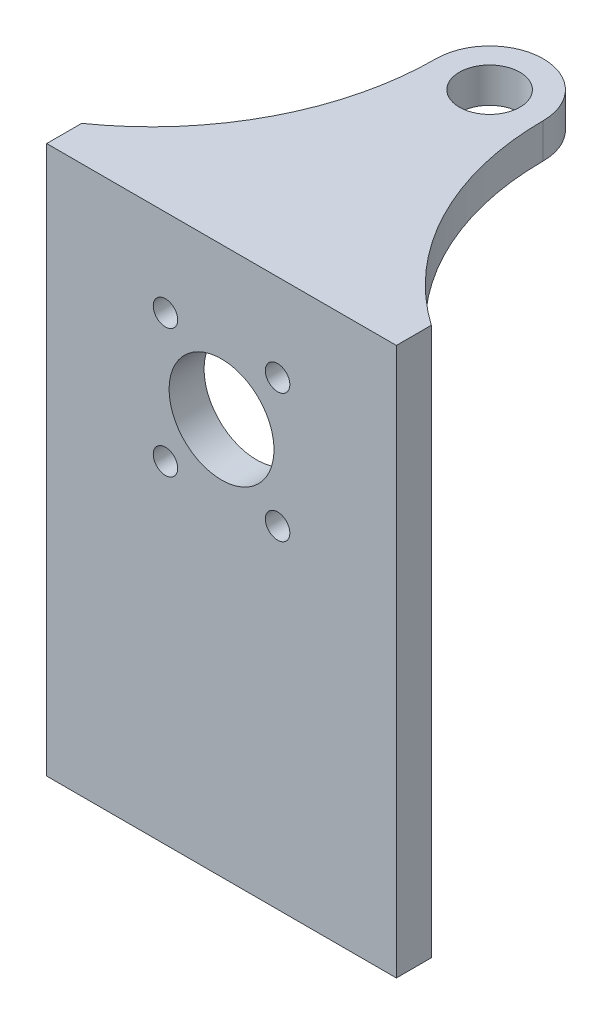
from build123d import *

# Parameters (mm, degrees)
BOSS_EXTRUDE1_DEPTH             = 3
SKETCH2_W                       = 30
SKETCH2_H                       = 3
BOSS_EXTRUDE2_DEPTH             = 44
BOSS_EXTRUDE2_DIRECTION_2_REACH = 76.018
SKETCH3_R                       = 1
CUT_EXTRUDE1_DEPTH              = 10
SKETCH5_R                       = 4.5
SKETCH5_R_2                     = 1.05
CUT_EXTRUDE2_DEPTH              = 90.56424105


with BuildPart() as part:
    # Sketch1 → Boss-Extrude1 (new body)
    with BuildSketch(Plane(origin=(0, 0, 0), x_dir=(1, 0, 0), z_dir=(0, 1, 0))):
        with BuildLine():
            ThreePointArc((-52.563656192, 11.590548397), (-53.910964998, 14.843239591), (-57.163656192, 16.190548397))
            Line((-57.163656192, 16.190548397), (-57.163656192, 14.190548397))
            ThreePointArc((-57.163656192, 14.190548397), (-55.32517856, 13.429026028), (-54.563656192, 11.590548397))
            ThreePointArc((-54.563656192, 11.590548397), (-55.32517856, 9.752070766), (-57.163656192, 8.990548397))
            Line((-57.163656192, 8.990548397), (-57.163656192, 6.990548397))
            ThreePointArc((-57.163656192, 6.990548397), (-53.910964998, 8.337857204), (-52.563656192, 11.590548397))
        make_face()
        with BuildLine():
            Line((-57.163656192, 14.190548397), (-57.163656192, 16.190548397))
            ThreePointArc((-57.163656192, 16.190548397), (-60.416347385, 14.843239591), (-61.763656192, 11.590548397))
            ThreePointArc((-61.763656192, 11.590548397), (-60.416347385, 8.337857204), (-57.163656192, 6.990548397))
            Line((-57.163656192, 6.990548397), (-57.163656192, 8.990548397))
            ThreePointArc((-57.163656192, 8.990548397), (-59.763656192, 11.590548397), (-57.163656192, 14.190548397))
        make_face()
        with BuildLine():
            ThreePointArc((-42.163656192, -8.409451603), (-49.808275889, 0.319346154), (-52.563656192, 11.590548397))
            ThreePointArc((-52.563656192, 11.590548397), (-53.910964998, 8.337857204), (-57.163656192, 6.990548397))
            Line((-57.163656192, 6.990548397), (-57.163656192, -8.409451603))
            Line((-57.163656192, -8.409451603), (-42.163656192, -8.409451603))
        make_face()
        with BuildLine():
            ThreePointArc((-57.163656192, 6.990548397), (-60.416347385, 8.337857204), (-61.763656192, 11.590548397))
            ThreePointArc((-61.763656192, 11.590548397), (-64.519036494, 0.319346154), (-72.163656192, -8.409451603))
            Line((-72.163656192, -8.409451603), (-57.163656192, -8.409451603))
            Line((-57.163656192, -8.409451603), (-57.163656192, 6.990548397))
        make_face()
    extrude(amount=-BOSS_EXTRUDE1_DEPTH)

    # Sketch2 → Boss-Extrude2 (add)
    with BuildSketch(Plane(origin=(0, -3, 0), x_dir=(-1, 0, 0), z_dir=(0, -1, 0))):
        with Locations((57.163656192, -9.909451603)):
            Rectangle(SKETCH2_W, SKETCH2_H)
    extrude(amount=BOSS_EXTRUDE2_DEPTH)

    # Boss-Extrude2 direction 2: up to this face of the body (flat: up to its plane)
    boss_extrude2_direction_2_end = Plane(part.part.faces().sort_by_distance((-57.163656192, 0, -0.136432956))[0])
    # Sketch2 → Boss-Extrude2 direction 2 (add, up to the picked face)
    with BuildSketch(Plane(origin=(0, -3, 0), x_dir=(-1, 0, 0), z_dir=(0, -1, 0)), mode=Mode.PRIVATE) as boss_extrude2_direction_2_sk1:
        with Locations((57.163656192, -9.909451603)):
            Rectangle(SKETCH2_W, SKETCH2_H)
    boss_extrude2_direction_2_tool1 = split(extrude(boss_extrude2_direction_2_sk1.sketch, amount=-BOSS_EXTRUDE2_DIRECTION_2_REACH, mode=Mode.PRIVATE), bisect_by=boss_extrude2_direction_2_end, keep=Keep.BOTH, mode=Mode.PRIVATE)
    add(boss_extrude2_direction_2_tool1.solids().sort_by(Axis((-57.163656, -3, 9.909452), (0, 1, 0)))[0])

    # Sketch3 → Cut-Extrude1 (cut)
    with BuildSketch(Plane(origin=(0, -47, 0), x_dir=(-1, 0, 0), z_dir=(0, -1, 0))):
        with Locations(Location((47.163656192, -9.909451603, 0), (0, 0, 90))):
            Circle(SKETCH3_R)
        with Locations(Location((67.163656192, -9.909451603, 0), (0, 0, 90))):
            Circle(SKETCH3_R)
    extrude(amount=-CUT_EXTRUDE1_DEPTH, mode=Mode.SUBTRACT)

    # Sketch5 → Cut-Extrude2 (cut, through all)
    with BuildSketch(Plane(origin=(0, 0, 8.409451603), x_dir=(-1, 0, 0), z_dir=(0, 0, -1))):
        with Locations((57.163656192, -13)):
            Circle(SKETCH5_R)
        with Locations((52.353656192, -7.485)):
            Circle(SKETCH5_R_2)
        with Locations((52.353656192, -18.515)):
            Circle(SKETCH5_R_2)
        with Locations((61.973656192, -7.485)):
            Circle(SKETCH5_R_2)
        with Locations((61.973656192, -18.515)):
            Circle(SKETCH5_R_2)
    extrude(amount=-CUT_EXTRUDE2_DEPTH, mode=Mode.SUBTRACT)


solid = part.part
